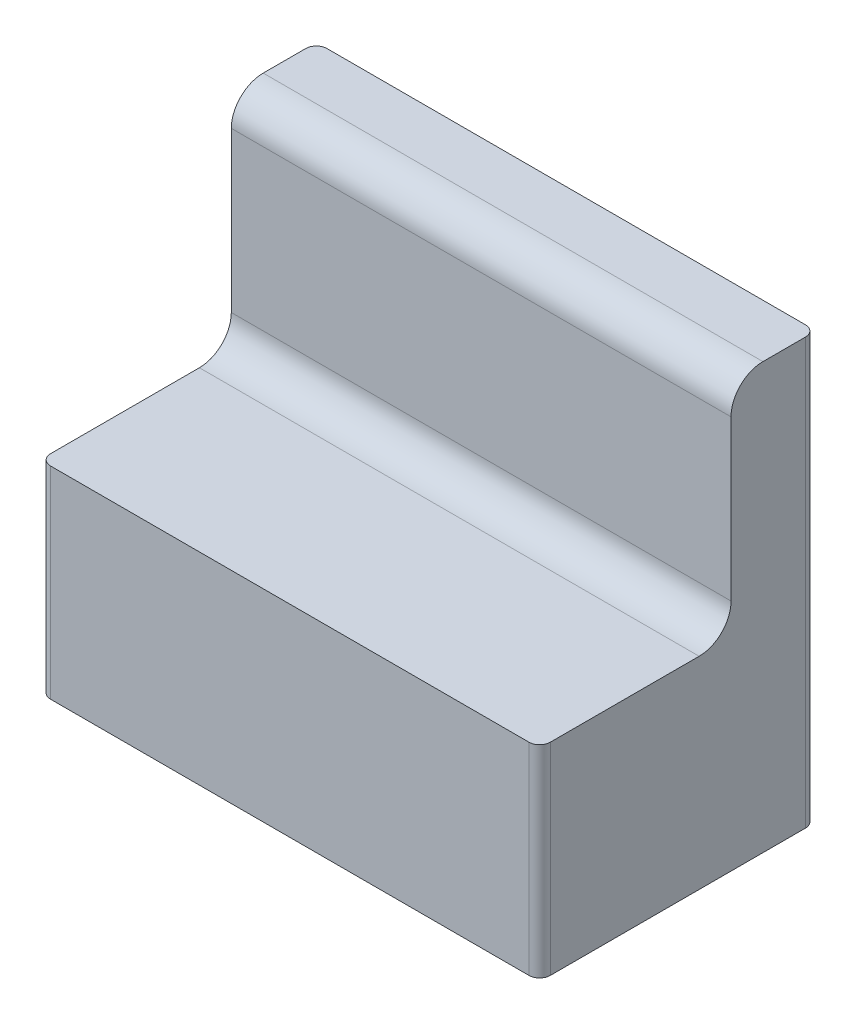
from build123d import *

# Parameters (mm, degrees)
SKETCH1_W                   = 47
SKETCH1_H                   = 26
BOSS_EXTRUDE1_DEPTH         = 40
CUT_EXTRUDE1_REACH          = 65.071
SKETCH2_W                   = 18
SKETCH2_H                   = 21
FILLET1_R                   = 3
M6_TAPPED_HOLE1_D           = 5
M6_TAPPED_HOLE1_DEPTH       = 15
M6_TAPPED_HOLE1_CSINK_D     = 6.05
M6_TAPPED_HOLE1_CSINK_ANGLE = 90
M6_TAPPED_HOLE1_TIP         = 1.502151548
FILLET2_R                   = 1


with BuildPart() as part:
    # Sketch1 → Boss-Extrude1 (new body)
    with BuildSketch(Plane(origin=(0, 0, 0), x_dir=(1, 0, 0), z_dir=(0, 1, 0))):
        Rectangle(SKETCH1_W, SKETCH1_H)
    extrude(amount=-BOSS_EXTRUDE1_DEPTH)

    # Sketch2 → Cut-Extrude1 (cut, up to next)
    with BuildSketch(Plane(origin=(23.5, 0, 0), x_dir=(0, 0, -1), z_dir=(1, 0, 0)), mode=Mode.PRIVATE) as cut_extrude1_sk1:
        with Locations((-4, -10.5)):
            Rectangle(SKETCH2_W, SKETCH2_H)
    cut_extrude1_tool1 = extrude(cut_extrude1_sk1.sketch, amount=-CUT_EXTRUDE1_REACH, mode=Mode.PRIVATE) & part.part
    add(cut_extrude1_tool1.solids().sort_by_distance((23.5, -10.5, 4))[0], mode=Mode.SUBTRACT)

    # Fillet1
    fillet1_edges = [part.edges().sort_by_distance(p)[0] for p in [
        (0, 0, -5),
        (0, -21, -5),
    ]]
    fillet(fillet1_edges, radius=FILLET1_R)

    # M6 Tapped Hole1
    with Locations(Plane(origin=(0, -40, 0), x_dir=(-1, 0, 0), z_dir=(0, -1, 0))):
        with Locations((-15.5, 0), (15.5, 0)):
            CounterSinkHole(M6_TAPPED_HOLE1_D / 2, M6_TAPPED_HOLE1_CSINK_D / 2, depth=M6_TAPPED_HOLE1_DEPTH, counter_sink_angle=M6_TAPPED_HOLE1_CSINK_ANGLE)
            with Locations((0, 0, -(M6_TAPPED_HOLE1_DEPTH + M6_TAPPED_HOLE1_TIP / 2))):  # 118° drill point
                Cone(0, M6_TAPPED_HOLE1_D / 2, M6_TAPPED_HOLE1_TIP, mode=Mode.SUBTRACT)

    # Fillet2
    fillet2_edges = [part.edges().sort_by_distance(p)[0] for p in [
        (23.5, -30.5, 13),
        (-23.5, -30.5, 13),
        (-23.5, -20, -13),
        (23.5, -20, -13),
    ]]
    fillet(fillet2_edges, radius=FILLET2_R)


solid = part.part
